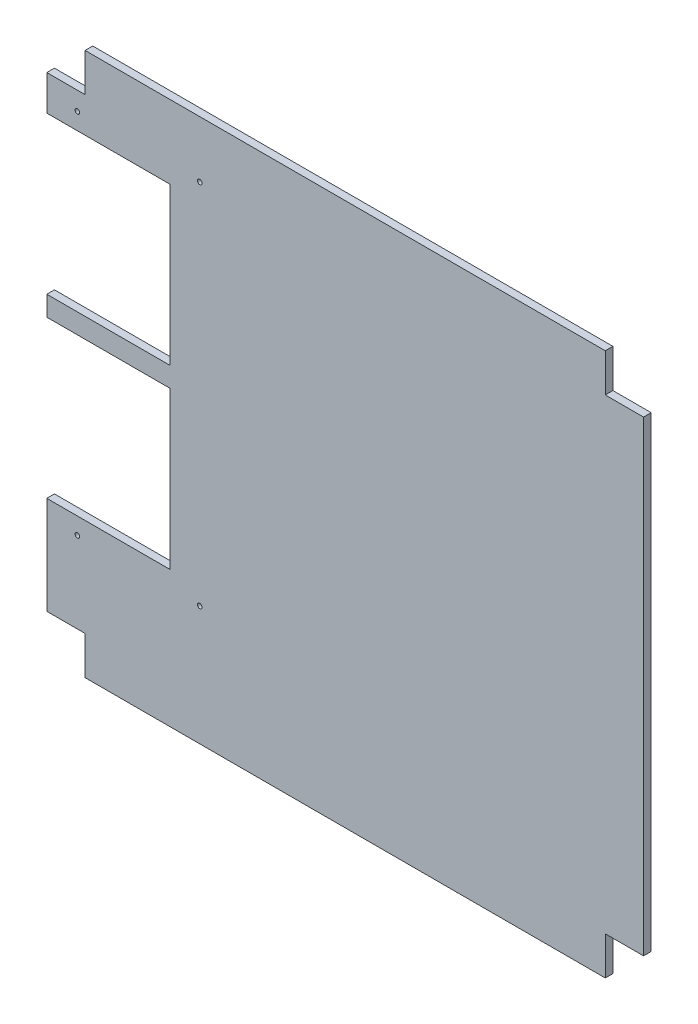
from build123d import *

# Parameters (mm, degrees)
ESQUISSE1_W             = 390
ESQUISSE1_H             = 355
BOSS_EXTRU_1_DEPTH      = 5
ESQUISSE3_W             = 80.434472185
ESQUISSE3_H             = 102.5
ESQUISSE3_H_2           = 103.87880101
ESQUISSE3_W_2           = 25.03
ESQUISSE3_H_3           = 25.03
ENL_V_MAT_EXTRU_1_DEPTH = 10
ESQUISSE4_W             = 80.434472185
ESQUISSE4_H             = 5
BOSS_EXTRU_2_DEPTH      = 1.38
ESQUISSE9_R             = 1.5
ENL_V_MAT_EXTRU_2_DEPTH = 264.735189158


with BuildPart() as part:
    # Esquisse1 → Boss.-Extru.1 (new body)
    with BuildSketch(Plane.XY):
        Rectangle(ESQUISSE1_W, ESQUISSE1_H)
    extrude(amount=BOSS_EXTRU_1_DEPTH)

    # Esquisse3 → Enlèv. mat.-Extru.1 (cut)
    with BuildSketch(Plane(origin=(0, 0, 0), x_dir=(-1, 0, 0), z_dir=(0, 0, -1))):
        with Locations((154.782763907, 78.25)):
            Rectangle(ESQUISSE3_W, ESQUISSE3_H)
        with Locations((154.782763907, -36.560599495)):
            Rectangle(ESQUISSE3_W, ESQUISSE3_H_2)
        with Locations((-182.485, 164.985)):
            Rectangle(ESQUISSE3_W_2, ESQUISSE3_H_3)
        with Locations((182.485, 164.985)):
            Rectangle(ESQUISSE3_W_2, ESQUISSE3_H_3)
        with Locations((182.485, -164.985)):
            Rectangle(ESQUISSE3_W_2, ESQUISSE3_H_3)
        with Locations((-182.485, -164.985)):
            Rectangle(ESQUISSE3_W_2, ESQUISSE3_H_3)
    extrude(amount=-ENL_V_MAT_EXTRU_1_DEPTH, mode=Mode.SUBTRACT)

    # Esquisse4 → Boss.-Extru.2 (add)
    with BuildSketch(Plane.XZ.offset(-15.37880101)):
        with Locations((-154.782763907, 2.5)):
            Rectangle(ESQUISSE4_W, ESQUISSE4_H)
    extrude(amount=BOSS_EXTRU_2_DEPTH)

    # Esquisse9 → Enlèv. mat.-Extru.2 (cut, through all)
    with BuildSketch(Plane(origin=(0, 0, 0), x_dir=(-1, 0, 0), z_dir=(0, 0, -1))):
        with Locations((175, -99.5)):
            Circle(ESQUISSE9_R)
        with Locations(Location((95, -99.5, 0), (0, 0, 180))):
            Circle(ESQUISSE9_R)
        with Locations((95, 140.5)):
            Circle(ESQUISSE9_R)
        with Locations(Location((175, 140.5, 0), (0, 0, 180))):
            Circle(ESQUISSE9_R)
    extrude(amount=-ENL_V_MAT_EXTRU_2_DEPTH, mode=Mode.SUBTRACT)


solid = part.part
